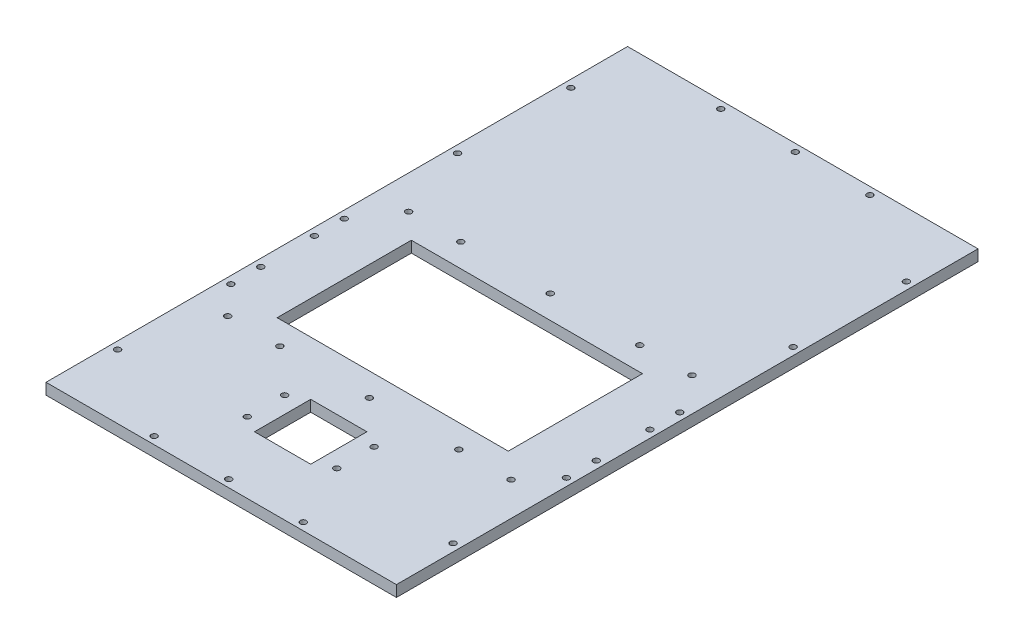
from build123d import *

# Parameters (mm, degrees)
SKETCH1_W                  = 298.45
SKETCH1_H                  = 495.3
BOSS_EXTRUDE1_DEPTH        = 4.7625
CUT_EXTRUDE1_DEPTH         = 290.291114191
CUT_EXTRUDE1_DEPTH_BACK    = 290.291114191
SKETCH3_W                  = 196.85
SKETCH3_H                  = 114.3
SKETCH20_W                 = 47.879
SKETCH20_H                 = 47.879
CUT_EXTRUDE5_DEPTH         = 290.291114191
F_10_CLEARANCE_HOLE1_D     = 5.1054
F_10_CLEARANCE_HOLE1_DEPTH = 10.668
F_10_CLEARANCE_HOLE1_TIP   = 1.533816902
F_10_CLEARANCE_HOLE4_D     = 5.1054
LPATTERN3_COUNT            = 3
LPATTERN3_PITCH            = 63.5
MIRROR2_COPY_1_D           = 5.1054
MIRROR2_COPY_2_D           = 5.1054
F_10_CLEARANCE_HOLE5_D     = 5.1054
LPATTERN4_COUNT            = 3
LPATTERN4_PITCH            = 96.52
LPATTERN4_COL_COUNT        = 3
LPATTERN4_COL_PITCH        = 96.52
MIRROR3_COPY_1_D           = 5.1054
MIRROR3_COPY_2_D           = 5.1054
MIRROR3_COPY_3_D           = 5.1054
MIRROR3_COPY_4_D           = 5.1054
F_10_CLEARANCE_HOLE6_D     = 5.1054
F_10_CLEARANCE_HOLE7_D     = 5.1054
F_10_CLEARANCE_HOLE8_D     = 5.1054


with BuildPart() as part:
    # Sketch1 → Boss-Extrude1 (new, symmetric)
    with BuildSketch(Plane(origin=(0, 0, 0), x_dir=(1, 0, 0), z_dir=(0, 1, 0))):
        Rectangle(SKETCH1_W, SKETCH1_H)
    extrude(amount=BOSS_EXTRUDE1_DEPTH, both=True)

    # Sketch3 → Cut-Extrude1 (cut, two sides: drawn at the far end of the back side and taken through both)
    with BuildSketch(Plane(origin=(0, 4.7625, 0), x_dir=(1, 0, 0), z_dir=(0, 1, 0)).offset(-CUT_EXTRUDE1_DEPTH_BACK)):
        with Locations((0, -44.45)):
            Rectangle(SKETCH3_W, SKETCH3_H)
    extrude(amount=CUT_EXTRUDE1_DEPTH + CUT_EXTRUDE1_DEPTH_BACK, mode=Mode.SUBTRACT)

    # Sketch20 → Cut-Extrude5 (cut, through all)
    with BuildSketch(Plane.XZ.offset(4.7625)):
        with Locations((0, 171.45)):
            Rectangle(SKETCH20_W, SKETCH20_H)
    extrude(amount=-CUT_EXTRUDE5_DEPTH, mode=Mode.SUBTRACT)

    # #10 Clearance Hole1
    with Locations(Plane(origin=(0, -4.7625, 0), x_dir=(-1, 0, 0), z_dir=(0, -1, 0))):
        with Locations((-38.1, -155.575), (38.1, -155.575), (38.1, -187.325), (-38.1, -187.325)):
            Hole(F_10_CLEARANCE_HOLE1_D / 2, depth=F_10_CLEARANCE_HOLE1_DEPTH)
            with Locations((0, 0, -(F_10_CLEARANCE_HOLE1_DEPTH + F_10_CLEARANCE_HOLE1_TIP / 2))):  # 118° drill point
                Cone(0, F_10_CLEARANCE_HOLE1_D / 2, F_10_CLEARANCE_HOLE1_TIP, mode=Mode.SUBTRACT)

    # #10 Clearance Hole4 (through all)
    with Locations(Plane(origin=(0, 4.7625, 0), x_dir=(1, 0, 0), z_dir=(0, 1, 0))):
        with Locations((-63.5, 241.3)):
            f_10_clearance_hole4 = Hole(F_10_CLEARANCE_HOLE4_D / 2)

    # LPattern3: #10 Clearance Hole4 ×3
    with Locations(*[(i * LPATTERN3_PITCH, 0, 0) for i in range(1, LPATTERN3_COUNT)]):
        add(f_10_clearance_hole4, mode=Mode.SUBTRACT)

    # Mirror2: #10 Clearance Hole4 across plane
    add(f_10_clearance_hole4.mirror(Plane.XY), mode=Mode.SUBTRACT)

    # Mirror2 copy 1 (through all)
    with Locations(Plane(origin=(63.5, 4.7625, 0), x_dir=(1, 0, 0), z_dir=(0, 1, 0))):
        with Locations((-63.5, -241.3)):
            Hole(MIRROR2_COPY_1_D / 2)

    # Mirror2 copy 2 (through all)
    with Locations(Plane(origin=(127, 4.7625, 0), x_dir=(1, 0, 0), z_dir=(0, 1, 0))):
        with Locations((-63.5, -241.3)):
            Hole(MIRROR2_COPY_2_D / 2)

    # #10 Clearance Hole5 (through all)
    with Locations(Plane(origin=(0, 4.7625, 0), x_dir=(1, 0, 0), z_dir=(0, 1, 0))):
        with Locations((-142.875, 0)):
            f_10_clearance_hole5 = Hole(F_10_CLEARANCE_HOLE5_D / 2)

    # LPattern4: #10 Clearance Hole5 ×3
    with Locations(*[(0, 0, -i * LPATTERN4_PITCH) for i in range(1, LPATTERN4_COUNT)]):
        add(f_10_clearance_hole5, mode=Mode.SUBTRACT)

    # LPattern4 col: #10 Clearance Hole5 ×3
    with Locations(*[(0, 0, i * LPATTERN4_COL_PITCH) for i in range(1, LPATTERN4_COL_COUNT)]):
        add(f_10_clearance_hole5, mode=Mode.SUBTRACT)

    # Mirror3: #10 Clearance Hole5 across plane
    add(f_10_clearance_hole5.mirror(Plane(origin=(0, 0, 0), x_dir=(0, 0, 1), z_dir=(1, 0, 0))), mode=Mode.SUBTRACT)

    # Mirror3 copy 1 (through all)
    with Locations(Plane(origin=(0, 4.7625, -96.52), x_dir=(-1, 0, 0), z_dir=(0, 1, 0))):
        with Locations((-142.875, 0)):
            Hole(MIRROR3_COPY_1_D / 2)

    # Mirror3 copy 2 (through all)
    with Locations(Plane(origin=(0, 4.7625, -193.04), x_dir=(-1, 0, 0), z_dir=(0, 1, 0))):
        with Locations((-142.875, 0)):
            Hole(MIRROR3_COPY_2_D / 2)

    # Mirror3 copy 3 (through all)
    with Locations(Plane(origin=(0, 4.7625, 96.52), x_dir=(-1, 0, 0), z_dir=(0, 1, 0))):
        with Locations((-142.875, 0)):
            Hole(MIRROR3_COPY_3_D / 2)

    # Mirror3 copy 4 (through all)
    with Locations(Plane(origin=(0, 4.7625, 193.04), x_dir=(-1, 0, 0), z_dir=(0, 1, 0))):
        with Locations((-142.875, 0)):
            Hole(MIRROR3_COPY_4_D / 2)

    # #10 Clearance Hole6 (through all)
    with Locations(Plane(origin=(0, 4.7625, 0), x_dir=(1, 0, 0), z_dir=(0, 1, 0))):
        with Locations((120.65, 32.5755), (120.65, -121.4755), (-120.65, -121.4755), (-120.65, 32.5755)):
            Hole(F_10_CLEARANCE_HOLE6_D / 2)

    # #10 Clearance Hole7 (through all)
    with Locations(Plane(origin=(0, 4.7625, 0), x_dir=(1, 0, 0), z_dir=(0, 1, 0))):
        with Locations((76.2, 32.5755), (0, 32.5755), (-76.2, 32.5755), (76.2, -121.4755), (0, -121.4755), (-76.2, -121.4755)):
            Hole(F_10_CLEARANCE_HOLE7_D / 2)

    # #10 Clearance Hole8 (through all)
    with Locations(Plane(origin=(0, 4.7625, 0), x_dir=(1, 0, 0), z_dir=(0, 1, 0))):
        with Locations((-142.875, -71.12), (142.875, -25.4), (-142.875, -25.4), (142.875, -71.12)):
            Hole(F_10_CLEARANCE_HOLE8_D / 2)


solid = part.part
